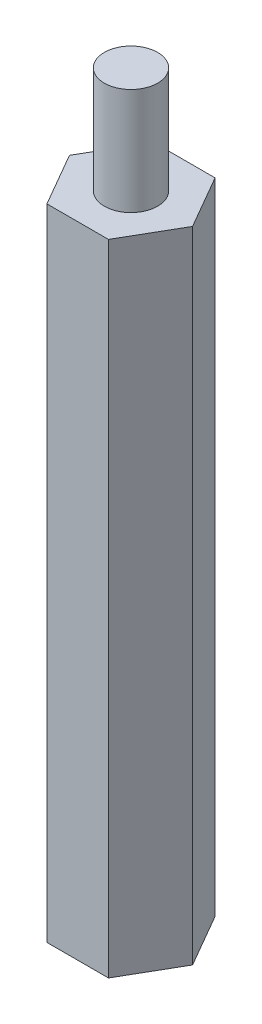
from build123d import *

# Parameters (mm, degrees)
BOSS_EXTRUDE1_DEPTH = 76.2
SKETCH2_R           = 3.175
BOSS_EXTRUDE2_DEPTH = 12.7


with BuildPart() as part:
    # Sketch1 → Boss-Extrude1 (new body)
    with BuildSketch(Plane(origin=(0, 0, 0), x_dir=(1, 0, 0), z_dir=(0, 1, 0))):
        Polygon((3.666174209, -6.35), (7.332348419, 0), (3.666174209, 6.35), (-3.666174209, 6.35), (-7.332348419, 0), (-3.666174209, -6.35), align=None)
    extrude(amount=BOSS_EXTRUDE1_DEPTH)

    # Sketch2 → Boss-Extrude2 (add)
    with BuildSketch(Plane(origin=(0, 76.2, 0), x_dir=(1, 0, 0), z_dir=(0, 1, 0))):
        with Locations(Location((0, 0, 0), (0, 0, 270))):
            Circle(SKETCH2_R)
    extrude(amount=BOSS_EXTRUDE2_DEPTH)


solid = part.part
